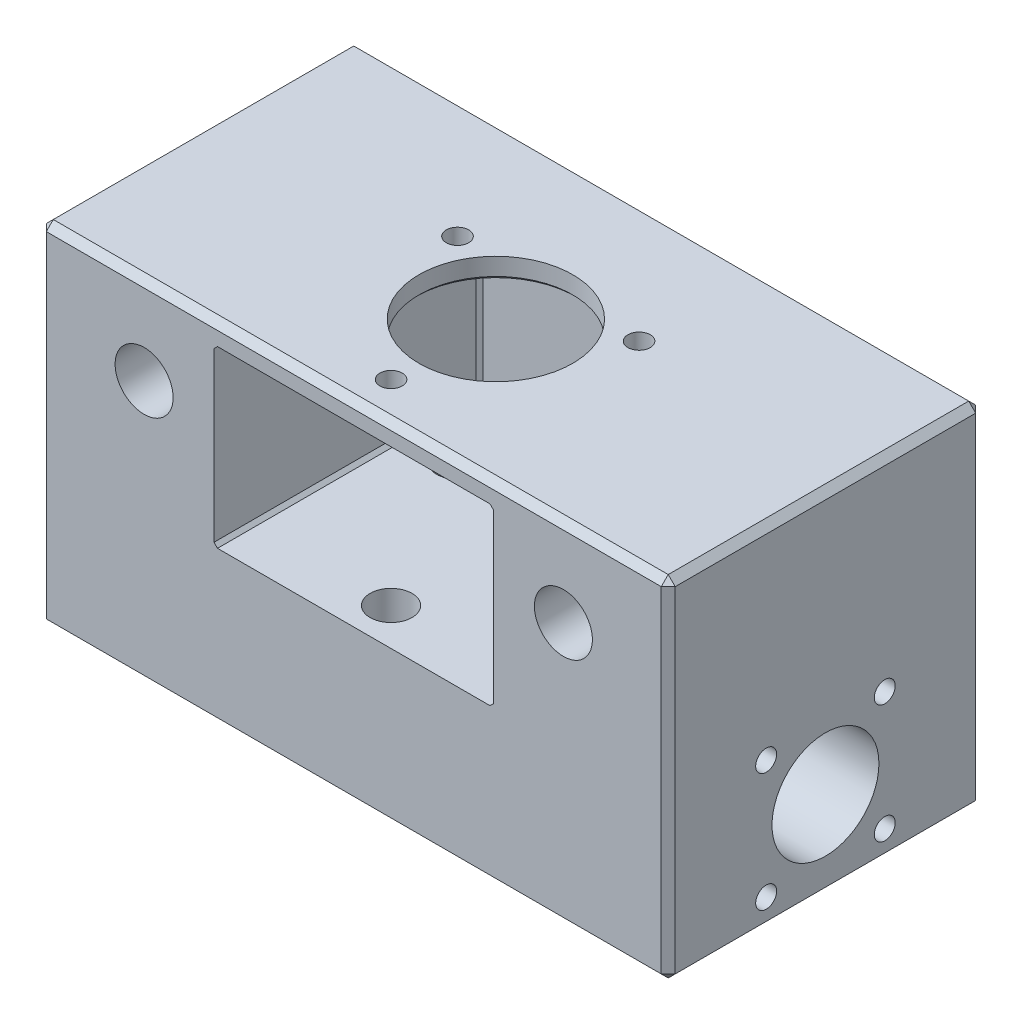
from build123d import *

# Parameters (mm, degrees)
SKETCH1_W           = 90
SKETCH1_H           = 45
BOSS_EXTRUDE1_DEPTH = 50
SKETCH2_R           = 4.15
CUT_EXTRUDE1_DEPTH  = 28.296664924
SKETCH3_R           = 7.65
CUT_EXTRUDE2_DEPTH  = 106.386194542
SKETCH4_R           = 1.5
CUT_EXTRUDE3_DEPTH  = 10
CHAMFER1_SIZE       = 1
SKETCH6_W           = 40
SKETCH6_H           = 25
CUT_EXTRUDE5_DEPTH  = 38
CUT_EXTRUDE4_REACH  = 72.931
SKETCH5_R           = 1.6
SKETCH5_R_2         = 11
CUT_EXTRUDE6_REACH  = 72.931
SKETCH8_R           = 3
CHAMFER2_SIZE       = 0.5


with BuildPart() as part:
    # Sketch1 → Boss-Extrude1 (new body)
    with BuildSketch(Plane(origin=(0, 0, 0), x_dir=(1, 0, 0), z_dir=(0, 1, 0))):
        Rectangle(SKETCH1_W, SKETCH1_H)
    extrude(amount=BOSS_EXTRUDE1_DEPTH)

    # Sketch2 → Cut-Extrude1 (cut)
    with BuildSketch(Plane.XY.offset(22.5)):
        with Locations((-30, 37.5)):
            Circle(SKETCH2_R)
        with Locations(Location((30, 37.5, 0), (0, 0, 180))):
            Circle(SKETCH2_R)
    extrude(amount=-CUT_EXTRUDE1_DEPTH, mode=Mode.SUBTRACT)

    # Sketch3 → Cut-Extrude2 (cut, through all)
    with BuildSketch(Plane(origin=(45, 0, 0), x_dir=(0, 0, -1), z_dir=(1, 0, 0))):
        with Locations((0, 12.5)):
            Circle(SKETCH3_R)
    extrude(amount=-CUT_EXTRUDE2_DEPTH, mode=Mode.SUBTRACT)

    # Sketch4 → Cut-Extrude3 (cut)
    with BuildSketch(Plane(origin=(45, 0, 0), x_dir=(0, 0, -1), z_dir=(1, 0, 0))):
        with Locations((-8.485281374, 20.985281374)):
            Circle(SKETCH4_R)
        with Locations((8.485281374, 20.985281374)):
            Circle(SKETCH4_R)
        with Locations((8.485281374, 4.014718626)):
            Circle(SKETCH4_R)
        with Locations((-8.485281374, 4.014718626)):
            Circle(SKETCH4_R)
    cut_extrude3 = extrude(amount=-CUT_EXTRUDE3_DEPTH, mode=Mode.SUBTRACT)

    # Mirror1: Cut-Extrude3 across plane
    add(cut_extrude3.mirror(Plane(origin=(0, 0, 0), x_dir=(0, 0, 1), z_dir=(1, 0, 0))), mode=Mode.SUBTRACT)

    # Chamfer1
    chamfer1_edges = [part.edges().sort_by_distance(p)[0] for p in [
        (-45, 50, 0),
        (0, 50, 22.5),
        (45, 50, 0),
        (0, 0, 22.5),
        (-45, 0, 0),
        (0, 0, -22.5),
        (45, 0, 0),
        (45, 25, 22.5),
        (-45, 25, 22.5),
        (-45, 25, -22.5),
        (45, 25, -22.5),
        (0, 50, -22.5),
    ]]
    chamfer(chamfer1_edges, length=CHAMFER1_SIZE)

    # Sketch6 → Cut-Extrude5 (cut)
    with BuildSketch(Plane.XY.offset(22.5)):
        with Locations((0, 34.5)):
            Rectangle(SKETCH6_W, SKETCH6_H)
    extrude(amount=-CUT_EXTRUDE5_DEPTH, mode=Mode.SUBTRACT)

    # Sketch5 → Cut-Extrude4 (cut, up to next)
    with BuildSketch(Plane(origin=(0, 50, 0), x_dir=(1, 0, 0), z_dir=(0, 1, 0)), mode=Mode.PRIVATE) as cut_extrude4_sk1:
        with Locations(Location((0, -17.164837936, 0), (0, 0, 270))):
            Circle(SKETCH5_R)
    cut_extrude4_tool1 = extrude(cut_extrude4_sk1.sketch, amount=-CUT_EXTRUDE4_REACH, mode=Mode.PRIVATE) & part.part
    # Sketch5 → Cut-Extrude4 (cut, up to next)
    with BuildSketch(Plane(origin=(0, 50, 0), x_dir=(1, 0, 0), z_dir=(0, 1, 0)), mode=Mode.PRIVATE) as cut_extrude4_sk2:
        with Locations(Location((-12.990381057, 5.335162064, 0), (0, 0, 270))):
            Circle(SKETCH5_R)
    cut_extrude4_tool2 = extrude(cut_extrude4_sk2.sketch, amount=-CUT_EXTRUDE4_REACH, mode=Mode.PRIVATE) & part.part
    # Sketch5 → Cut-Extrude4 (cut, up to next)
    with BuildSketch(Plane(origin=(0, 50, 0), x_dir=(1, 0, 0), z_dir=(0, 1, 0)), mode=Mode.PRIVATE) as cut_extrude4_sk3:
        with Locations(Location((12.990381057, 5.335162064, 0), (0, 0, 270))):
            Circle(SKETCH5_R)
    cut_extrude4_tool3 = extrude(cut_extrude4_sk3.sketch, amount=-CUT_EXTRUDE4_REACH, mode=Mode.PRIVATE) & part.part
    # Sketch5 → Cut-Extrude4 (cut, up to next)
    with BuildSketch(Plane(origin=(0, 50, 0), x_dir=(1, 0, 0), z_dir=(0, 1, 0)), mode=Mode.PRIVATE) as cut_extrude4_sk4:
        with Locations(Location((0, -2.164837936, 0), (0, 0, 270))):
            Circle(SKETCH5_R_2)
    cut_extrude4_tool4 = extrude(cut_extrude4_sk4.sketch, amount=-CUT_EXTRUDE4_REACH, mode=Mode.PRIVATE) & part.part
    add(cut_extrude4_tool1.solids().sort_by_distance((0, 50, 17.164838))[0], mode=Mode.SUBTRACT)
    add(cut_extrude4_tool2.solids().sort_by_distance((-12.990381, 50, -5.335162))[0], mode=Mode.SUBTRACT)
    add(cut_extrude4_tool3.solids().sort_by_distance((12.990381, 50, -5.335162))[0], mode=Mode.SUBTRACT)
    add(cut_extrude4_tool4.solids().sort_by_distance((0, 50, 2.164838))[0], mode=Mode.SUBTRACT)

    # Sketch8 → Cut-Extrude6 (cut, up to next)
    with BuildSketch(Plane.XZ, mode=Mode.PRIVATE) as cut_extrude6_sk1:
        with Locations(Location((0, 17.164837936, 0), (0, 0, 270))):
            Circle(SKETCH8_R)
    cut_extrude6_tool1 = extrude(cut_extrude6_sk1.sketch, amount=-CUT_EXTRUDE6_REACH, mode=Mode.PRIVATE) & part.part
    # Sketch8 → Cut-Extrude6 (cut, up to next)
    with BuildSketch(Plane.XZ, mode=Mode.PRIVATE) as cut_extrude6_sk2:
        with Locations(Location((12.990381057, -5.335162064, 0), (0, 0, 270))):
            Circle(SKETCH8_R)
    cut_extrude6_tool2 = extrude(cut_extrude6_sk2.sketch, amount=-CUT_EXTRUDE6_REACH, mode=Mode.PRIVATE) & part.part
    # Sketch8 → Cut-Extrude6 (cut, up to next)
    with BuildSketch(Plane.XZ, mode=Mode.PRIVATE) as cut_extrude6_sk3:
        with Locations(Location((-12.990381057, -5.335162064, 0), (0, 0, 270))):
            Circle(SKETCH8_R)
    cut_extrude6_tool3 = extrude(cut_extrude6_sk3.sketch, amount=-CUT_EXTRUDE6_REACH, mode=Mode.PRIVATE) & part.part
    add(cut_extrude6_tool1.solids().sort_by_distance((0, 0, 17.164838))[0], mode=Mode.SUBTRACT)
    add(cut_extrude6_tool2.solids().sort_by_distance((12.990381, 0, -5.335162))[0], mode=Mode.SUBTRACT)
    add(cut_extrude6_tool3.solids().sort_by_distance((-12.990381, 0, -5.335162))[0], mode=Mode.SUBTRACT)

    # Chamfer2
    chamfer2_edges = [part.edges().sort_by_distance(p)[0] for p in [
        (20, 34.5, -15.5),
        (20, 47, 3.5),
        (0, 22, -15.5),
        (20, 22, 3.5),
        (-20, 34.5, -15.5),
        (-20, 22, 3.5),
        (0, 47, -15.5),
        (-20, 47, 3.5),
        (0, 47, -8.835162064),
    ]]
    chamfer(chamfer2_edges, length=CHAMFER2_SIZE)


solid = part.part
